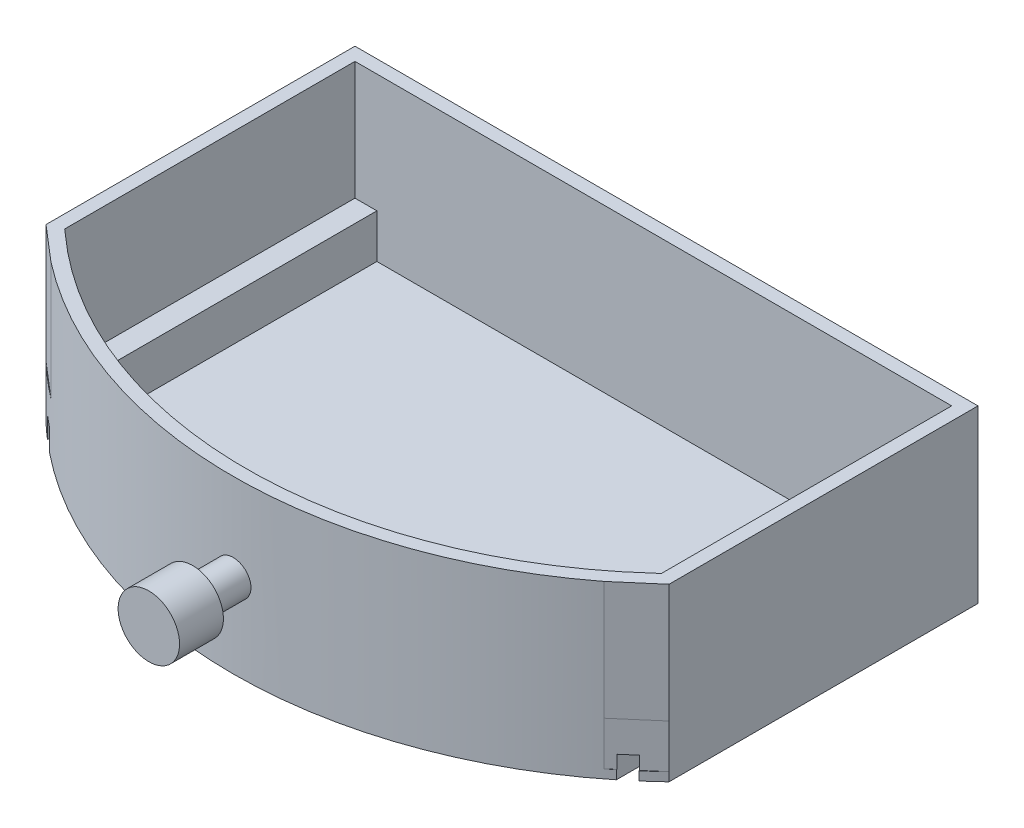
from build123d import *
from build123d.topology import SkipClean

# Parameters (mm, degrees)
EXTRUDE_1_DEPTH      = 2
EXTRUDE_2_DEPTH      = 10
CUT_EXTRUDE_1_DEPTH  = 5
SKETCH_4_W           = 126
SKETCH_4_H           = 3
EXTRUDE_4_DEPTH      = 37
EXTRUDE_5_DEPTH      = 27
SKETCH_6_R           = 4
EXTRUDE_6_DEPTH      = 110
SKETCH_7_W           = 8
SKETCH_7_H           = 92.720195249
CUT_EXTRUDE_2_DEPTH  = 25
EXTRUDE_7_DEPTH      = 5
EXTRUDE_7_DEPTH_BACK = 5
SKETCH_8_R           = 7


with BuildPart() as part:
    # 草图1 → 凸台-拉伸1 (new body)
    with BuildSketch(Plane(origin=(0, 0, 0), x_dir=(1, 0, 0), z_dir=(0, 1, 0))):
        with BuildLine():
            Line((0, 0), (0, -70.42))
            ThreePointArc((0, -70.42), (71, -98.800967575), (142, -70.42))
            Line((142, -70.42), (142, 0))
            Line((142, 0), (0, 0))
        make_face()
    extrude(amount=EXTRUDE_1_DEPTH)

    # 草图2 → 凸台-拉伸2 (add)
    with BuildSketch(Plane(origin=(0, 2, 0), x_dir=(1, 0, 0), z_dir=(0, 1, 0))):
        with BuildLine():
            Line((8, 0), (8, -77.287162725))
            ThreePointArc((8, -77.287162725), (3.912076489, -73.956009121), (0, -70.42))
            Line((0, -70.42), (0, 0))
            Line((0, 0), (8, 0))
        make_face()
        Polygon((134, -77.287162725), (134, 0), (142, 0), (142, -70.42), align=None)
    extrude(amount=EXTRUDE_2_DEPTH)

    # 草图3 → 切除-拉伸1 (cut)
    with BuildSketch(Plane.XZ):
        Polygon((3.6, 0), (3.6, 73.687038217), (3.6, 76.02465485), (6.4, 76.02465485), (6.4, 0), align=None)
        Polygon((138.4, 0), (138.4, 73.687038217), (138.4, 76.02465485), (135.6, 76.02465485), (135.6, 0), align=None)
    extrude(amount=-CUT_EXTRUDE_1_DEPTH, mode=Mode.SUBTRACT)

    # 草图4 → 凸台-拉伸4 (add)
    with SkipClean():  # the faces are left unmerged after this step: merging them gives an invalid solid
        with BuildSketch(Plane(origin=(0, 2, 0), x_dir=(1, 0, 0), z_dir=(0, 1, 0))):
            with Locations((71, -1.5)):
                Rectangle(SKETCH_4_W, SKETCH_4_H)
            with BuildLine():
                Line((8, -73.460480837), (8, -77.287162725))
                ThreePointArc((8, -77.287162725), (71.023325312, -98.800964934), (134.036900158, -77.258620491))
                Line((134.036900158, -77.258620491), (134, -73.460480837))
                ThreePointArc((134, -73.460480837), (71, -95.800967575), (8, -73.460480837))
            make_face()
        extrude(amount=EXTRUDE_4_DEPTH)

    # 草图5 → 凸台-拉伸5 (add)
    with SkipClean():  # the faces are left unmerged after this step: merging them gives an invalid solid
        with BuildSketch(Plane(origin=(0, 12, 0), x_dir=(1, 0, 0), z_dir=(0, 1, 0))):
            Polygon((134, 0), (142, 0), (142, -70.42), (134.036900158, -77.258620491), (134, -73.460480837), (139, -69.16653713), (139, -3), (134, -3), align=None)
            Polygon((8, -3), (8, 0), (0, 0), (0, -70.42), (8, -77.287162725), (8, -73.460480837), (3, -69.168504133), (3, -3), align=None)
        extrude(amount=EXTRUDE_5_DEPTH)

    # 草图6 → 凸台-拉伸6 (add)
    with BuildSketch(Plane.XY.offset(3)):
        with Locations((71.018450079, 19)):
            Circle(SKETCH_6_R)
    extrude(amount=EXTRUDE_6_DEPTH)

    # 草图7 → 切除-拉伸2 (cut)
    with BuildSketch(Plane(origin=(0, 39, 0), x_dir=(1, 0, 0), z_dir=(0, 1, 0))):
        with Locations((71.018450079, -49.360097624)):
            Rectangle(SKETCH_7_W, SKETCH_7_H)
    extrude(amount=-CUT_EXTRUDE_2_DEPTH, mode=Mode.SUBTRACT)

    # 草图8 → 凸台-拉伸7 (add, two sides: drawn at the far end of the back side and taken through both)
    with BuildSketch(Plane.XY.offset(113).offset(-EXTRUDE_7_DEPTH_BACK)):
        with Locations((71.018450079, 19)):
            Circle(SKETCH_8_R)
    extrude(amount=EXTRUDE_7_DEPTH + EXTRUDE_7_DEPTH_BACK)


solid = part.part
